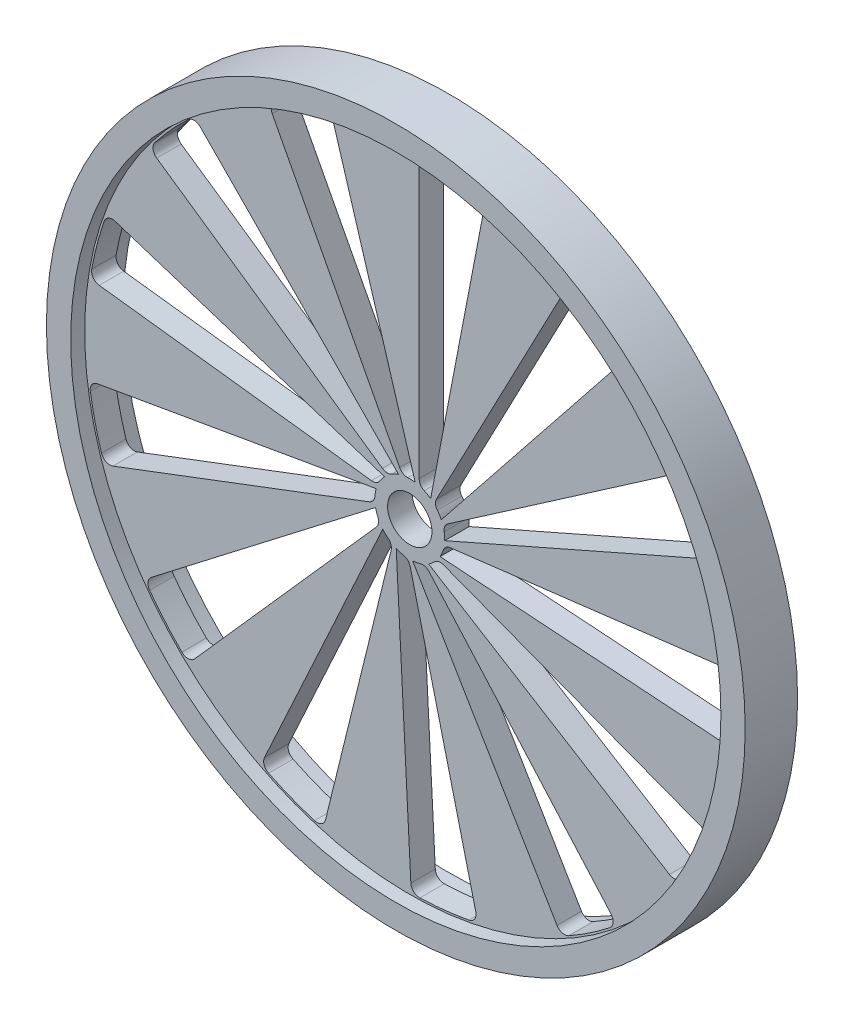
from build123d import *

# Parameters (mm, degrees)
SKETCH1_R           = 200
SKETCH1_R_2         = 12.7
BOSS_EXTRUDE1_DEPTH = 30
SKETCH2_R           = 186.107166766
CUT_EXTRUDE3_DEPTH  = 8


with BuildPart() as part:
    # Sketch1 → Boss-Extrude1 (new body)
    with BuildSketch(Plane.XY):
        Circle(SKETCH1_R)
        Circle(SKETCH1_R_2, mode=Mode.SUBTRACT)
        with BuildLine():
            Line((5.373353022, 179.700844592), (5.373353022, 22.746286446))
            ThreePointArc((5.373353022, 22.746286446), (6.167799965, 20.041970731), (8.298682417, 18.197029157))
            ThreePointArc((8.298682417, 18.197029157), (10.179469581, 17.215644021), (11.945725569, 16.040562354))
            Line((11.945725569, 16.040562354), (42.519793553, 175.083108319))
            ThreePointArc((42.519793553, 175.083108319), (41.777732217, 178.788808127), (38.654411976, 180.916656046))
            ThreePointArc((38.654411976, 180.916656046), (24.73012638, 183.339632511), (10.661501717, 184.69253472))
            ThreePointArc((10.661501717, 184.69253472), (6.941206716, 183.336827504), (5.373353022, 179.700844592))
        make_face(mode=Mode.SUBTRACT)
        with BuildLine():
            Line((88.269014329, 156.620073998), (15.3285942, 17.643714734))
            ThreePointArc((15.3285942, 17.643714734), (14.775283856, 14.879964185), (15.804699463, 12.256079099))
            ThreePointArc((15.804699463, 12.256079099), (17.013981377, 10.51306034), (18.031835705, 8.651757112))
            Line((18.031835705, 8.651757112), (119.01458488, 135.268459916))
            ThreePointArc((119.01458488, 135.268459916), (120.079646768, 138.894547239), (118.302944275, 142.23014229))
            ThreePointArc((118.302944275, 142.23014229), (107.099615, 150.846519571), (95.271191525, 158.582470864))
            ThreePointArc((95.271191525, 158.582470864), (91.347005342, 159.110959035), (88.269014329, 156.620073998))
        make_face(mode=Mode.SUBTRACT)
        with BuildLine():
            Line((150.94330821, 97.659531928), (21.772239177, 8.499180607))
            ThreePointArc((21.772239177, 8.499180607), (19.997928277, 6.309137168), (19.690050329, 3.507409022))
            ThreePointArc((19.690050329, 3.507409022), (19.950795079, 1.402061232), (19.987069587, -0.719061419))
            Line((19.987069587, -0.719061419), (168.244569093, 64.465437509))
            ThreePointArc((168.244569093, 64.465437509), (170.872761362, 67.181219439), (170.849697746, 70.960416994))
            ThreePointArc((170.849697746, 70.960416994), (164.933872514, 83.796286896), (158.055399498, 96.14307406))
            ThreePointArc((158.055399498, 96.14307406), (154.826305895, 98.434687345), (150.94330821, 97.659531928))
        make_face(mode=Mode.SUBTRACT)
        with BuildLine():
            Line((179.038309244, 16.326368018), (23.228126543, -2.592413372))
            ThreePointArc((23.228126543, -2.592413372), (20.639288331, -3.707037141), (19.064647955, -6.044766194))
            ThreePointArc((19.064647955, -6.044766194), (18.317122063, -8.030133208), (17.363506697, -9.925151645))
            Line((17.363506697, -9.925151645), (178.931750093, -21.10583974))
            ThreePointArc((178.931750093, -21.10583974), (182.520985567, -19.922516113), (184.256844426, -16.565484669))
            ThreePointArc((184.256844426, -16.565484669), (184.983767504, -2.450665253), (184.631020219, 11.678457638))
            ThreePointArc((184.631020219, 11.678457638), (182.836765627, 15.208215052), (179.038309244, 16.326368018))
        make_face(mode=Mode.SUBTRACT)
        with BuildLine():
            Line((166.117791277, -68.746970051), (19.362730047, -13.090116689))
            ThreePointArc((19.362730047, -13.090116689), (16.552436159, -12.873973916), (14.071764489, -14.212158322))
            ThreePointArc((14.071764489, -14.212158322), (12.487217127, -15.622720904), (10.762173676, -16.85750924))
            Line((10.762173676, -16.85750924), (148.627823508, -101.842023456))
            ThreePointArc((148.627823508, -101.842023456), (152.355851595, -102.462243316), (155.452968583, -100.29643343))
            ThreePointArc((155.452968583, -100.29643343), (162.656110654, -88.136199526), (168.909899254, -75.461552688))
            ThreePointArc((168.909899254, -75.461552688), (168.961525775, -71.502276031), (166.117791277, -68.746970051))
        make_face(mode=Mode.SUBTRACT)
        with BuildLine():
            Line((115.141689264, -138.071205772), (11.061565443, -20.589032025))
            ThreePointArc((11.061565443, -20.589032025), (8.673620341, -19.091638415), (5.855209362, -19.123716253))
            ThreePointArc((5.855209362, -19.123716253), (3.796641234, -19.636331514), (1.695356364, -19.928014623))
            Line((1.695356364, -19.928014623), (84.275053717, -159.247426929))
            ThreePointArc((84.275053717, -159.247426929), (87.28782811, -161.529105379), (91.036691049, -161.050677996))
            ThreePointArc((91.036691049, -161.050677996), (103.065899072, -153.630792644), (114.493555954, -145.314230704))
            ThreePointArc((114.493555954, -145.314230704), (116.379236576, -141.832457371), (115.141689264, -138.071205772))
        make_face(mode=Mode.SUBTRACT)
        with BuildLine():
            Line((37.788013848, -175.764992189), (0.226329502, -23.37124825))
            ThreePointArc((0.226329502, -23.37124825), (-1.192217369, -20.935638632), (-3.702703668, -19.654261257))
            ThreePointArc((-3.702703668, -19.654261257), (-5.76369941, -19.151495219), (-7.75984666, -18.433252014))
            Line((-7.75984666, -18.433252014), (0.615884744, -180.171164031))
            ThreePointArc((0.615884744, -180.171164031), (2.223215138, -183.591596036), (5.765004707, -184.910153103))
            ThreePointArc((5.765004707, -184.910153103), (19.864532092, -183.930422619), (33.848118782, -181.877169691))
            ThreePointArc((33.848118782, -181.877169691), (37.135866798, -179.670531994), (37.788013848, -175.764992189))
        make_face(mode=Mode.SUBTRACT)
        with BuildLine():
            Line((-48.222440145, -173.193137093), (-10.660755799, -20.799393154))
            ThreePointArc((-10.660755799, -20.799393154), (-10.784932447, -17.98353634), (-12.412371909, -15.682251866))
            ThreePointArc((-12.412371909, -15.682251866), (-14.00364598, -14.279282169), (-15.43736233, -12.715653514))
            Line((-15.43736233, -12.715653514), (-83.184376002, -159.819858752))
            ThreePointArc((-83.184376002, -159.819858752), (-83.350709631, -163.59546456), (-80.827374738, -166.408940544))
            ThreePointArc((-80.827374738, -166.408940544), (-67.887559797, -172.093809374), (-54.551514489, -176.77424096))
            ThreePointArc((-54.551514489, -176.77424096), (-50.614882527, -176.348253002), (-48.222440145, -173.193137093))
        make_face(mode=Mode.SUBTRACT)
        with BuildLine():
            Line((-123.185714244, -130.944821493), (-19.105590424, -13.462647747))
            ThreePointArc((-19.105590424, -13.462647747), (-17.906949474, -10.911622598), (-18.278515332, -8.117627564))
            ThreePointArc((-18.278515332, -8.117627564), (-19.035526018, -6.135857658), (-19.578364331, -4.085052034))
            Line((-19.578364331, -4.085052034), (-147.928098686, -102.855749871))
            ThreePointArc((-147.928098686, -102.855749871), (-149.829991307, -106.121583693), (-148.903176705, -109.785445151))
            ThreePointArc((-148.903176705, -109.785445151), (-140.087429871, -120.832578356), (-130.454053207, -131.174463985))
            ThreePointArc((-130.454053207, -131.174463985), (-126.77037224, -132.626714474), (-123.185714244, -130.944821493))
        make_face(mode=Mode.SUBTRACT)
        with BuildLine():
            Line((-169.928625759, -58.698625345), (-23.173564529, -3.041771983))
            ThreePointArc((-23.173564529, -3.041771983), (-20.926700178, -1.339987618), (-19.957271172, 1.306647384))
            ThreePointArc((-19.957271172, 1.306647384), (-19.706596449, 3.413217897), (-19.234199009, 5.481385637))
            Line((-19.234199009, 5.481385637), (-178.783276688, -22.328628241))
            ThreePointArc((-178.783276688, -22.328628241), (-181.985027623, -24.336526905), (-182.867055368, -28.011427332))
            ThreePointArc((-182.867055368, -28.011427332), (-180.194957997, -41.890059828), (-176.471140477, -55.524198135))
            ThreePointArc((-176.471140477, -55.524198135), (-173.884297422, -58.521993984), (-169.928625759, -58.698625345))
        make_face(mode=Mode.SUBTRACT)
        with BuildLine():
            Line((-177.742936974, 26.994718474), (-21.932754273, 8.075937085))
            ThreePointArc((-21.932754273, 8.075937085), (-19.152396066, 8.538622377), (-17.064056697, 10.431585164))
            ThreePointArc((-17.064056697, 10.431585164), (-15.863123123, 12.180366365), (-14.483710491, 13.792103916))
            Line((-14.483710491, 13.792103916), (-168.681360573, 63.313713031))
            ThreePointArc((-168.681360573, 63.313713031), (-172.449487267, 63.02373491), (-174.938295432, 60.179670914))
            ThreePointArc((-174.938295432, 60.179670914), (-179.021992831, 46.648966577), (-182.060816172, 32.845992368))
            ThreePointArc((-182.060816172, 32.845992368), (-181.163425598, 28.98941006), (-177.742936974, 26.994718474))
        make_face(mode=Mode.SUBTRACT)
        with BuildLine():
            Line((-144.838483363, 106.503897613), (-15.667414331, 17.343546292))
            ThreePointArc((-15.667414331, 17.343546292), (-12.990508827, 16.461136886), (-10.261672478, 17.166772497))
            ThreePointArc((-10.261672478, 17.166772497), (-8.385599461, 18.157139689), (-6.415178447, 18.943217401))
            Line((-6.415178447, 18.943217401), (-119.936577581, 134.45164566))
            ThreePointArc((-119.936577581, 134.45164566), (-123.40784762, 135.946018575), (-126.933280248, 134.584331798))
            ThreePointArc((-126.933280248, 134.584331798), (-136.837246557, 124.50127692), (-145.942552953, 113.691561858))
            ThreePointArc((-145.942552953, 113.691561858), (-146.940196225, 109.85968962), (-144.838483363, 106.503897613))
        make_face(mode=Mode.SUBTRACT)
        with BuildLine():
            Line((-78.753278707, 161.61431732), (-5.812858579, 22.637958056))
            ThreePointArc((-5.812858579, 22.637958056), (-3.852652568, 20.612603314), (-1.10846276, 19.969259133))
            ThreePointArc((-1.10846276, 19.969259133), (1.01296398, 19.974331127), (3.122993668, 19.75466807))
            Line((3.122993668, 19.75466807), (-43.715770058, 174.788326586))
            ThreePointArc((-43.715770058, 174.788326586), (-46.094957309, 177.724707712), (-49.849380271, 178.157344184))
            ThreePointArc((-49.849380271, 178.157344184), (-63.304736163, 173.831845124), (-76.39060965, 168.491764657))
            ThreePointArc((-76.39060965, 168.491764657), (-79.054738718, 165.562438241), (-78.753278707, 161.61431732))
        make_face(mode=Mode.SUBTRACT)
    extrude(amount=BOSS_EXTRUDE1_DEPTH)

    # Sketch2 → Cut-Extrude3 (cut)
    with BuildSketch(Plane.XY):
        Circle(SKETCH2_R)
    cut_extrude3 = extrude(amount=CUT_EXTRUDE3_DEPTH, mode=Mode.SUBTRACT)

    # Mirror1: Cut-Extrude3 across plane
    add(cut_extrude3.mirror(Plane.XY.offset(15)), mode=Mode.SUBTRACT)


solid = part.part
